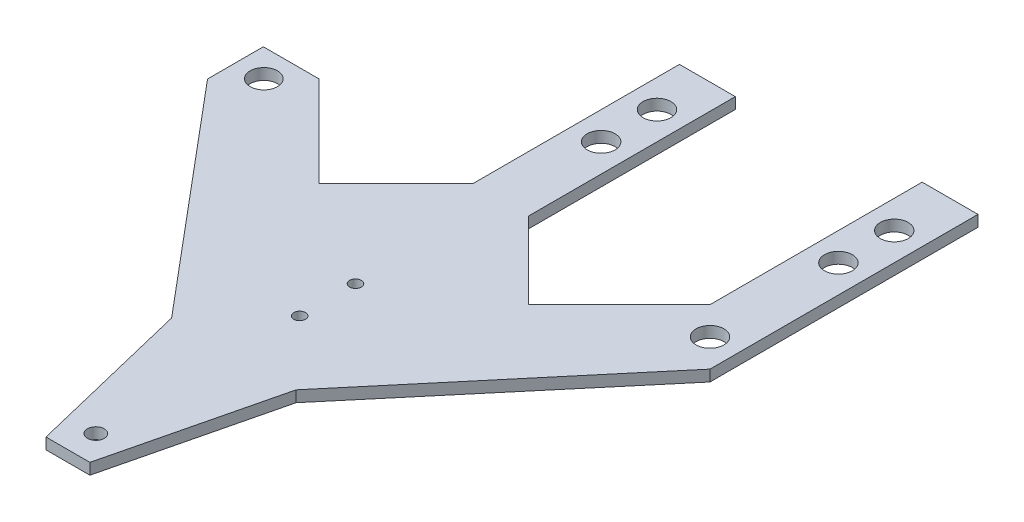
from build123d import *

# Parameters (mm, degrees)
SKETCH1_R           = 2.452812329
SKETCH1_R_2         = 2.5
SKETCH1_R_3         = 1.05
SKETCH1_R_4         = 1.5
BOSS_EXTRUDE1_DEPTH = 2


with BuildPart() as part:
    # Sketch1 → Boss-Extrude1 (new body)
    with BuildSketch(Plane(origin=(0, 0, 0), x_dir=(1, 0, 0), z_dir=(0, 1, 0))):
        Polygon((45, 45), (45, 35), (11.149880928, -5.279298766), (3.930911566, -35), (-3.930911566, -35), (-11.149880928, -5.279298766), (-45, 35), (-45, 45), (-35, 45), (-18.75, 28.75), (-5.004014664, 42.5), (-5.004014664, 79.531475099), (5, 79.531475099), (5, 42.5), (18.75, 28.75), (35, 45), (35, 83), (45, 83), align=None)
        with Locations(Location((-39.999958798, 40.081193315, 0), (0, 0, 270))):
            Circle(SKETCH1_R, mode=Mode.SUBTRACT)
        with Locations(Location((40, 40, 0), (0, 0, 270))):
            Circle(SKETCH1_R_2, mode=Mode.SUBTRACT)
        with Locations(Location((40, 63, 0), (0, 0, 270))):
            Circle(SKETCH1_R_2, mode=Mode.SUBTRACT)
        with Locations(Location((40, 73, 0), (0, 0, 270))):
            Circle(SKETCH1_R_2, mode=Mode.SUBTRACT)
        with Locations(Location((-0.004014664, 60.5, 0), (0, 0, 270))):
            Circle(SKETCH1_R_2, mode=Mode.SUBTRACT)
        with Locations(Location((0, 70.499999194, 0), (0, 0, 270))):
            Circle(SKETCH1_R_2, mode=Mode.SUBTRACT)
        with Locations(Location((0, 6.5, 0), (0, 0, 270))):
            Circle(SKETCH1_R_3, mode=Mode.SUBTRACT)
        with Locations(Location((0, 16.5, 0), (0, 0, 270))):
            Circle(SKETCH1_R_3, mode=Mode.SUBTRACT)
        with Locations(Location((0, -30, 0), (0, 0, 270))):
            Circle(SKETCH1_R_4, mode=Mode.SUBTRACT)
    extrude(amount=BOSS_EXTRUDE1_DEPTH)


solid = part.part
